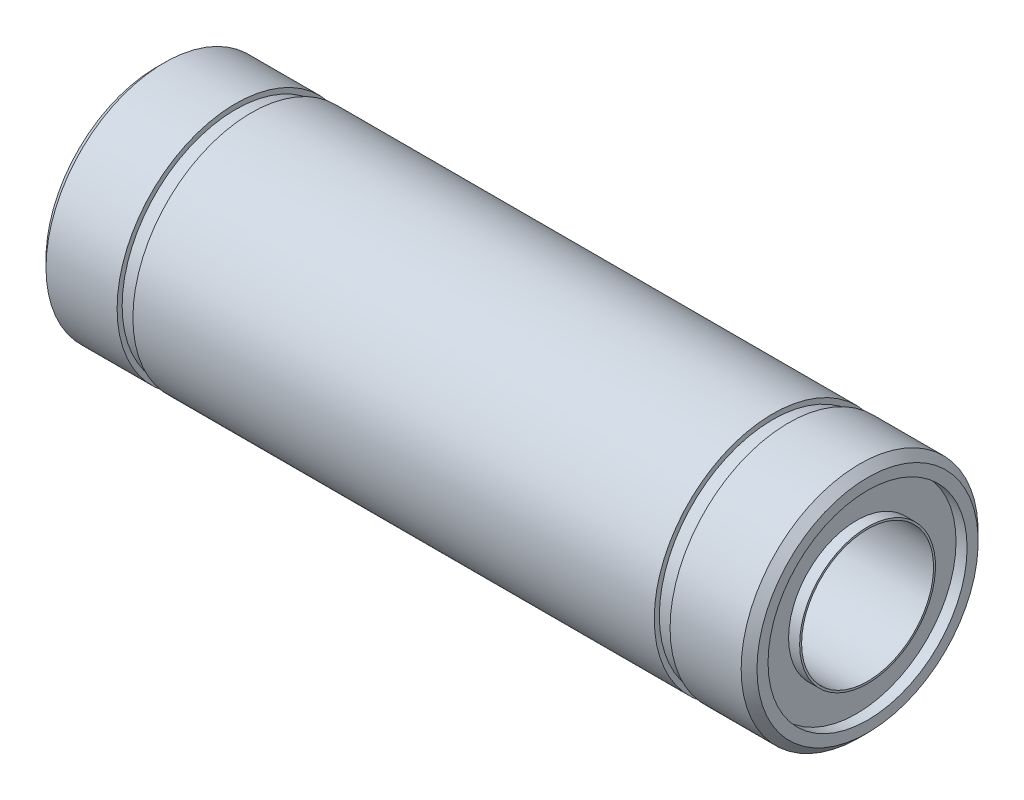
from build123d import *

# Parameters (mm, degrees)
ZKOSEN_1_SIZE = 0.5


with BuildPart() as part:
    # Skica1 → Rotovat1 (revolve)
    with BuildSketch(Plane.XY, mode=Mode.PRIVATE) as rotovat1_sk:
        Polygon((0, 4.3), (0, 4.175), (45, 4.175), (45, 4.3), (44.3, 4.3), (44.3, 6.3), (45, 6.3), (45, 7.5), (40, 7.5), (40, 7.18), (39, 7.18), (39, 7.5), (6, 7.5), (6, 7.18), (5, 7.18), (5, 7.5), (0, 7.5), (0, 6.3), (0.7, 6.3), (0.7, 4.3), align=None)
    revolve(rotovat1_sk.sketch.rotate(Axis((0, 0, 0), (1, 0, 0)), 90), axis=Axis((0, 0, 0), (1, 0, 0)))

    # Zkosení1
    zkosen_1_edges = [part.edges().sort_by_distance(p)[0] for p in [
        (0, 0, -7.5),
        (45, 0, -7.5),
    ]]
    chamfer(zkosen_1_edges, length=ZKOSEN_1_SIZE)


solid = part.part
